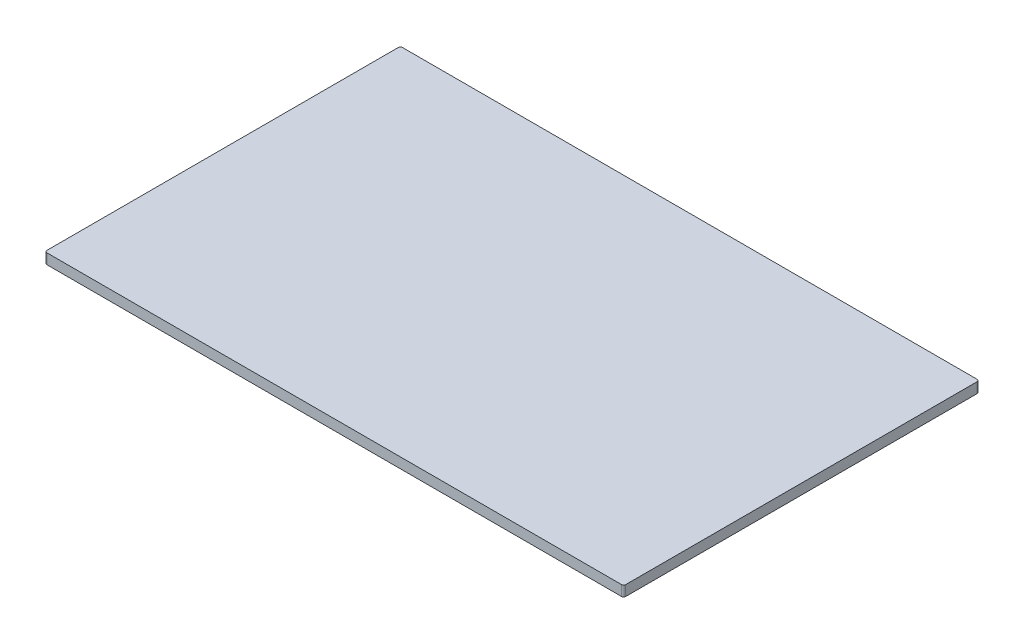
from build123d import *

# Parameters (mm, degrees)
SKETCH1_W           = 560
SKETCH1_H           = 344
BOSS_EXTRUDE1_DEPTH = 10
FILLET1_R           = 2


with BuildPart() as part:
    # Sketch1 → Boss-Extrude1 (new body)
    with BuildSketch(Plane(origin=(0, 0, 0), x_dir=(1, 0, 0), z_dir=(0, 1, 0))):
        Rectangle(SKETCH1_W, SKETCH1_H)
    extrude(amount=BOSS_EXTRUDE1_DEPTH)

    # Fillet1
    fillet1_edges = [part.edges().sort_by_distance(p)[0] for p in [
        (-280, 5, -172),
        (280, 5, -172),
        (280, 5, 172),
        (-280, 5, 172),
    ]]
    fillet(fillet1_edges, radius=FILLET1_R)


solid = part.part
